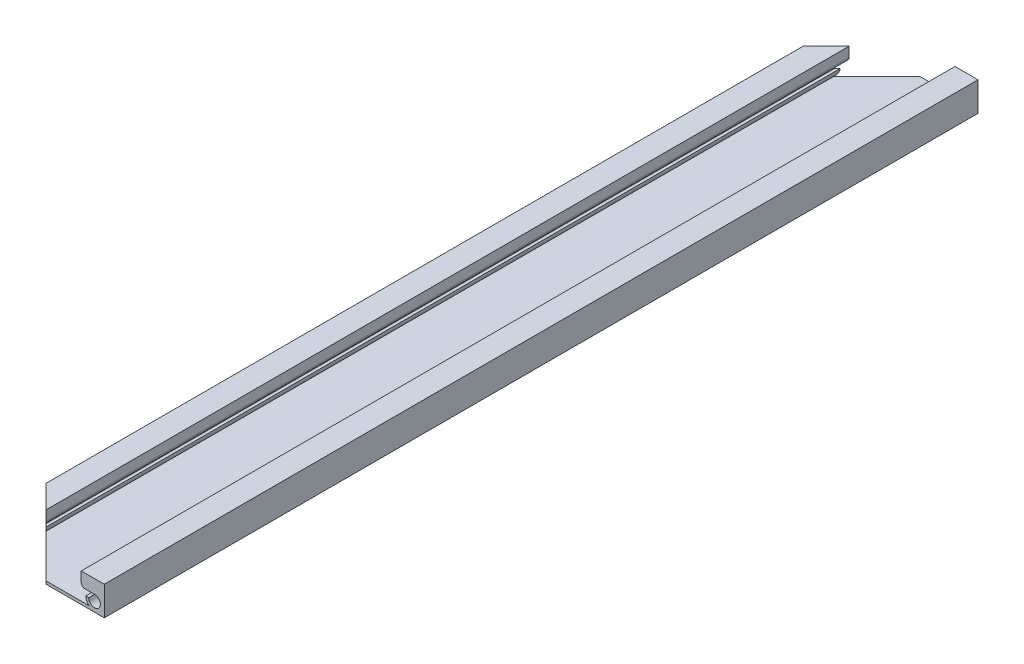
from build123d import *

# Parameters (mm, degrees)
SKETCH_1_W               = 60
SKETCH_1_H               = 15
EXTRUDE_1_DEPTH          = 510
SKETCH_2_R               = 3
CUT_EXTRUDE_1_DEPTH      = 511.936639908
CUT_EXTRUDE_2_DEPTH      = 511.936639908
SKETCH_4_W               = 36.3
SKETCH_4_H               = 7
CUT_EXTRUDE_3_DEPTH      = 511.936639908
FILLET_1_R               = 2
CUT_EXTRUDE_4_DEPTH      = 512.101751122
CUT_EXTRUDE_6_DEPTH      = 512.101751122
CUT_EXTRUDE_6_DEPTH_BACK = 512.101751122
SKETCH_7_W               = 30
SKETCH_7_H               = 30


with BuildPart() as part:
    # 스케치1 → 보스-돌출1 (new body)
    with BuildSketch(Plane.XY):
        Rectangle(SKETCH_1_W, SKETCH_1_H)
    extrude(amount=EXTRUDE_1_DEPTH)

    # 스케치2 → 컷-돌출1 (cut, through all)
    with BuildSketch(Plane(origin=(0, 0, 0), x_dir=(-1, 0, 0), z_dir=(0, 0, -1))):
        with Locations((-25, -2.5)):
            Circle(SKETCH_2_R)
        with Locations((25, -2.5)):
            Circle(SKETCH_2_R)
    extrude(amount=-CUT_EXTRUDE_1_DEPTH, mode=Mode.SUBTRACT)

    # 스케치3 → 컷-돌출2 (cut, through all)
    with BuildSketch(Plane(origin=(0, 0, 0), x_dir=(-1, 0, 0), z_dir=(0, 0, -1))):
        with BuildLine():
            Line((-22.171572875, -6), (22.171572875, -6))
            ThreePointArc((22.171572875, -6), (20.939339828, -4.439339828), (20.5, -2.5))
            Line((20.5, -2.5), (25, -2.5))
            Line((25, -2.5), (25, 0.5))
            Line((25, 0.5), (-25, 0.5))
            Line((-25, 0.5), (-25, -2.5))
            Line((-25, -2.5), (-20.5, -2.5))
            ThreePointArc((-20.5, -2.5), (-20.939339828, -4.439339828), (-22.171572875, -6))
        make_face()
    extrude(amount=-CUT_EXTRUDE_2_DEPTH, mode=Mode.SUBTRACT)

    # 스케치4 → 컷-돌출3 (cut, through all)
    with BuildSketch(Plane(origin=(0, 0, 0), x_dir=(-1, 0, 0), z_dir=(0, 0, -1))):
        with Locations((0.006888359, 4)):
            Rectangle(SKETCH_4_W, SKETCH_4_H)
    extrude(amount=-CUT_EXTRUDE_3_DEPTH, mode=Mode.SUBTRACT)

    # 필렛1
    fillet_1_edges = [part.edges().sort_by_distance(p)[0] for p in [
        (-18.156888359, 0.5, 255),
        (18.143111641, 0.5, 255),
    ]]
    fillet(fillet_1_edges, radius=FILLET_1_R)

    # 스케치5 → 컷-돌출4 (cut, through all)
    with BuildSketch(Plane.XZ.offset(7.5)):
        Polygon((-30, 510), (-30, 450), (30, 510), align=None)
        Polygon((-30, 0), (30, 0), (-30, 60), align=None)
    extrude(amount=-CUT_EXTRUDE_4_DEPTH, mode=Mode.SUBTRACT)

    # 스케치7 → 컷-돌출6 (cut, two sides: drawn at the far end of the back side and taken through both)
    with BuildSketch(Plane.XZ.offset(7.5).offset(-CUT_EXTRUDE_6_DEPTH_BACK)):
        with Locations((15, 15)):
            Rectangle(SKETCH_7_W, SKETCH_7_H)
        with Locations((15, 495)):
            Rectangle(SKETCH_7_W, SKETCH_7_H)
    extrude(amount=CUT_EXTRUDE_6_DEPTH + CUT_EXTRUDE_6_DEPTH_BACK, mode=Mode.SUBTRACT)


solid = part.part
